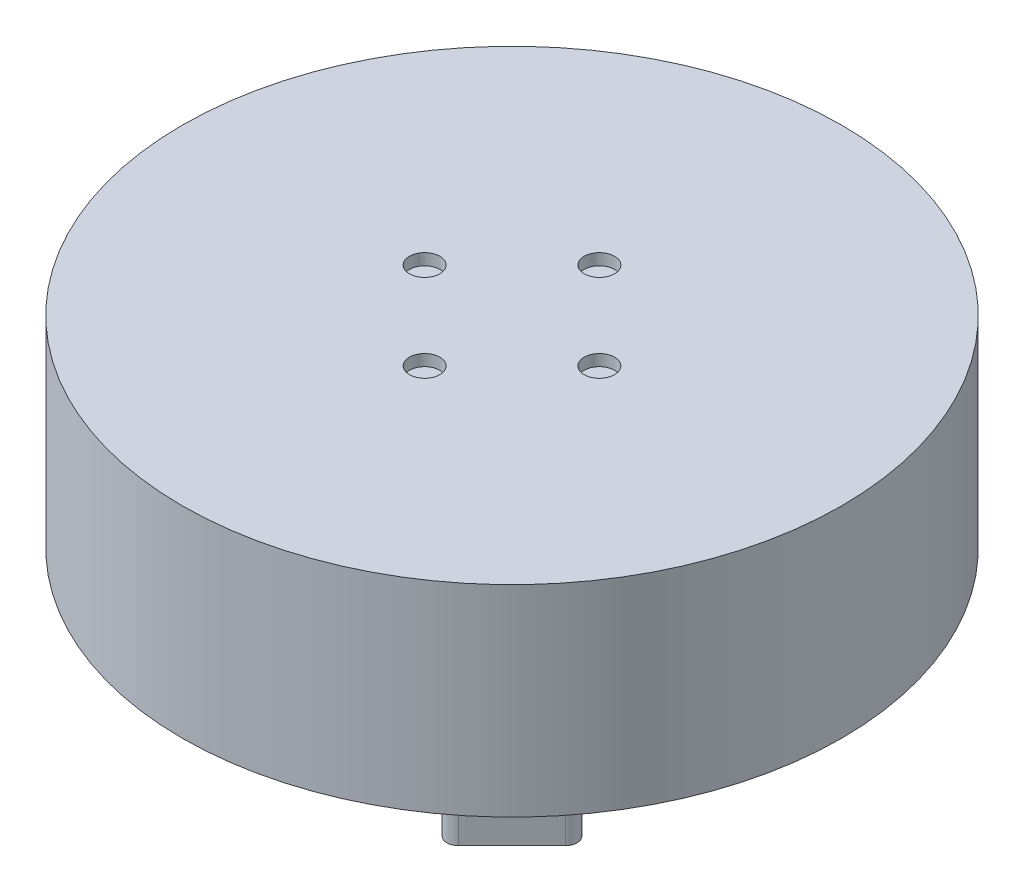
from build123d import *

# Parameters (mm, degrees)
SKETCH1_R           = 43.4
BOSS_EXTRUDE1_DEPTH = 26.5
SKETCH2_R           = 2
CUT_EXTRUDE1_DEPTH  = 1.5
BOSS_EXTRUDE2_DEPTH = 6
SKETCH4_R           = 2
CUT_EXTRUDE2_DEPTH  = 1.5


with BuildPart() as part:
    # Sketch1 → Boss-Extrude1 (new body)
    with BuildSketch(Plane(origin=(0, 0, 0), x_dir=(1, 0, 0), z_dir=(0, 1, 0))):
        with Locations(Location((0, 0, 0), (0, 0, 270))):
            Circle(SKETCH1_R)
    extrude(amount=BOSS_EXTRUDE1_DEPTH)

    # Sketch2 → Cut-Extrude1 (cut)
    with BuildSketch(Plane.XZ):
        with Locations(Location((0, 16, 0), (0, 0, 270))):
            Circle(SKETCH2_R)
        with Locations(Location((16, 0, 0), (0, 0, 270))):
            Circle(SKETCH2_R)
        with Locations(Location((0, -16, 0), (0, 0, 270))):
            Circle(SKETCH2_R)
        with Locations(Location((-16, 0, 0), (0, 0, 270))):
            Circle(SKETCH2_R)
    extrude(amount=-CUT_EXTRUDE1_DEPTH, mode=Mode.SUBTRACT)

    # Sketch3 → Boss-Extrude2 (add)
    with BuildSketch(Plane.XZ):
        with BuildLine():
            Line((24.395183951, 31.466251763), (31.466251763, 24.395183951))
            ThreePointArc((31.466251763, 24.395183951), (31.466251763, 22.273863607), (29.344931419, 22.273863607))
            Line((29.344931419, 22.273863607), (22.273863607, 29.344931419))
            ThreePointArc((22.273863607, 29.344931419), (22.273863607, 31.466251763), (24.395183951, 31.466251763))
        make_face()
    extrude(amount=BOSS_EXTRUDE2_DEPTH)

    # Sketch4 → Cut-Extrude2 (cut)
    with BuildSketch(Plane(origin=(0, 26.5, 0), x_dir=(1, 0, 0), z_dir=(0, 1, 0))):
        with Locations(Location((0, 11.5, 0), (0, 0, 270))):
            Circle(SKETCH4_R)
        with Locations(Location((11.5, 0, 0), (0, 0, 270))):
            Circle(SKETCH4_R)
        with Locations(Location((0, -11.5, 0), (0, 0, 270))):
            Circle(SKETCH4_R)
        with Locations(Location((-11.5, 0, 0), (0, 0, 270))):
            Circle(SKETCH4_R)
    extrude(amount=-CUT_EXTRUDE2_DEPTH, mode=Mode.SUBTRACT)


solid = part.part
